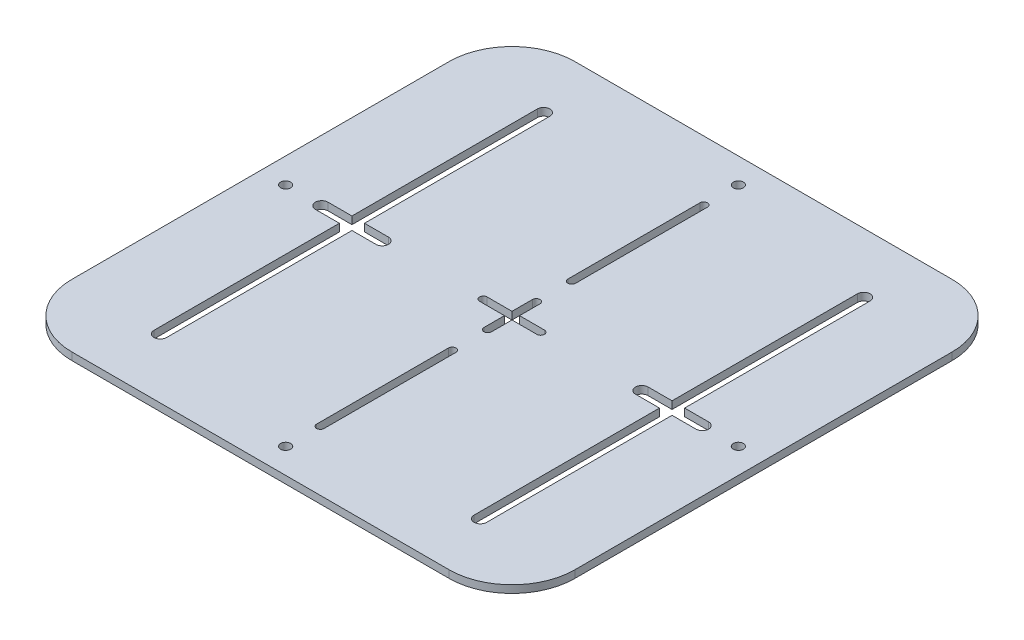
from build123d import *

# Parameters (mm, degrees)
SKETCH_1_W          = 200
SKETCH_1_H          = 200
SKETCH_1_R          = 2
EXTRUDE_1_DEPTH     = 3
FILLET_1_R          = 25
CUT_EXTRUDE_1_DEPTH = 3


with BuildPart() as part:
    # Эскиз1 → Бобышка-Вытянуть1 (new body)
    with BuildSketch(Plane(origin=(0, 0, 0), x_dir=(1, 0, 0), z_dir=(0, 1, 0))):
        Rectangle(SKETCH_1_W, SKETCH_1_H)
        with Locations(Location((-90, 0, 0), (0, 0, 270))):
            Circle(SKETCH_1_R, mode=Mode.SUBTRACT)
        with Locations(Location((0, 90, 0), (0, 0, 270))):
            Circle(SKETCH_1_R, mode=Mode.SUBTRACT)
        with Locations(Location((90, 0, 0), (0, 0, 270))):
            Circle(SKETCH_1_R, mode=Mode.SUBTRACT)
        with Locations(Location((0, -90, 0), (0, 0, 270))):
            Circle(SKETCH_1_R, mode=Mode.SUBTRACT)
        with BuildLine():
            Line((-66.14, -76.211231978), (-66.14, 76.211231978))
            ThreePointArc((-66.14, 76.211231978), (-63.64, 78.711231978), (-61.14, 76.211231978))
            Line((-61.14, 76.211231978), (-61.14, -76.211231978))
            ThreePointArc((-61.14, -76.211231978), (-63.64, -78.711231978), (-66.14, -76.211231978))
        make_face(mode=Mode.SUBTRACT)
        with BuildLine():
            Line((66.14, -76.211231978), (66.14, 76.211231978))
            ThreePointArc((66.14, 76.211231978), (63.64, 78.711231978), (61.14, 76.211231978))
            Line((61.14, 76.211231978), (61.14, -76.211231978))
            ThreePointArc((61.14, -76.211231978), (63.64, -78.711231978), (66.14, -76.211231978))
        make_face(mode=Mode.SUBTRACT)
        with BuildLine():
            Line((1.5, 76.211231978), (1.5, 23.747339046))
            ThreePointArc((1.5, 23.747339046), (0, 22.247339046), (-1.5, 23.747339046))
            Line((-1.5, 23.747339046), (-1.5, 76.211231978))
            ThreePointArc((-1.5, 76.211231978), (0, 77.711231978), (1.5, 76.211231978))
        make_face(mode=Mode.SUBTRACT)
        with BuildLine():
            Line((1.5, -76.211231978), (1.5, -23.747339046))
            ThreePointArc((1.5, -23.747339046), (0, -22.247339046), (-1.5, -23.747339046))
            Line((-1.5, -23.747339046), (-1.5, -76.211231978))
            ThreePointArc((-1.5, -76.211231978), (0, -77.711231978), (1.5, -76.211231978))
        make_face(mode=Mode.SUBTRACT)
        with BuildLine():
            Line((-1.5, -9.644775033), (-1.5, 9.644775033))
            ThreePointArc((-1.5, 9.644775033), (0, 11.144775033), (1.5, 9.644775033))
            Line((1.5, 9.644775033), (1.5, -9.644775033))
            ThreePointArc((1.5, -9.644775033), (0, -11.144775033), (-1.5, -9.644775033))
        make_face(mode=Mode.SUBTRACT)
    extrude(amount=EXTRUDE_1_DEPTH)

    # Скругление1
    fillet_1_edges = [part.edges().sort_by_distance(p)[0] for p in [
        (100, 1.5, 100),
        (-100, 1.5, 100),
        (-100, 1.5, -100),
        (100, 1.5, -100),
    ]]
    fillet(fillet_1_edges, radius=FILLET_1_R)

    # Эскиз2 → Вырез-Вытянуть1 (cut)
    with BuildSketch(Plane(origin=(0, 3, 0), x_dir=(1, 0, 0), z_dir=(0, 1, 0))):
        with BuildLine():
            Line((51.61254098, 2.5), (75.66745902, 2.5))
            ThreePointArc((75.66745902, 2.5), (78.16745902, 0), (75.66745902, -2.5))
            Line((75.66745902, -2.5), (51.61254098, -2.5))
            ThreePointArc((51.61254098, -2.5), (49.11254098, 0), (51.61254098, 2.5))
        make_face()
        with BuildLine():
            Line((-51.61254098, 2.5), (-75.66745902, 2.5))
            ThreePointArc((-75.66745902, 2.5), (-78.16745902, 0), (-75.66745902, -2.5))
            Line((-75.66745902, -2.5), (-51.61254098, -2.5))
            ThreePointArc((-51.61254098, -2.5), (-49.11254098, 0), (-51.61254098, 2.5))
        make_face()
        with BuildLine():
            Line((-11.396089986, 1.5), (11.396089986, 1.5))
            ThreePointArc((11.396089986, 1.5), (12.896089986, 0), (11.396089986, -1.5))
            Line((11.396089986, -1.5), (-11.396089986, -1.5))
            ThreePointArc((-11.396089986, -1.5), (-12.896089986, 0), (-11.396089986, 1.5))
        make_face()
    extrude(amount=-CUT_EXTRUDE_1_DEPTH, mode=Mode.SUBTRACT)


solid = part.part
